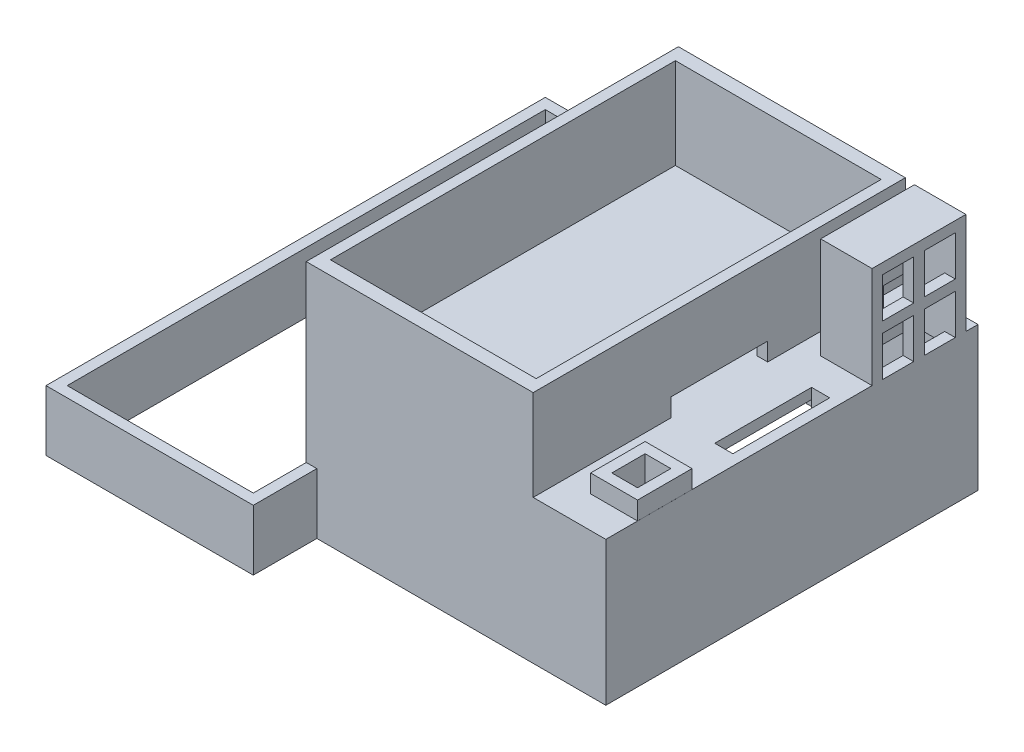
from build123d import *

# Parameters (mm, degrees)
SKETCH1_W               = 49.5
SKETCH1_H               = 61.5
BOSS_EXTRUDE1_DEPTH     = 23.75
SKETCH2_W               = 46
SKETCH2_H               = 58
CUT_EXTRUDE1_DEPTH      = 22
SKETCH3_W               = 3
SKETCH3_H               = 16
CUT_EXTRUDE2_DEPTH      = 1.75
SKETCH7_W               = 3
SKETCH7_H               = 5
BOSS_EXTRUDE2_DEPTH     = 4
SKETCH11_W              = 37.5
SKETCH11_H              = 61.5
BOSS_EXTRUDE3_DEPTH     = 15
SKETCH12_W              = 34
SKETCH12_H              = 57
CUT_EXTRUDE3_DEPTH      = 15
SKETCH14_W              = 7.75
SKETCH14_H              = 9
BOSS_EXTRUDE4_DEPTH     = 3
SKETCH15_W              = 4.25
SKETCH15_H              = 5.5
CUT_EXTRUDE4_DEPTH      = 4.75
SKETCH16_W              = 8.5
SKETCH16_H              = 15.5
BOSS_EXTRUDE5_DEPTH     = 16.75
SKETCH17_W              = 5.125
SKETCH17_H              = 6.625
CUT_EXTRUDE5_DEPTH      = 8.5
CUT_EXTRUDE6_DEPTH      = 15
CUT_EXTRUDE6_DEPTH_BACK = 1.75
SKETCH18_W              = 5
SKETCH18_H              = 12
SKETCH20_W              = 16
SKETCH20_H              = 3
CUT_EXTRUDE7_DEPTH      = 1.75
SKETCH21_W              = 34.25
SKETCH21_H              = 82.5
BOSS_EXTRUDE7_DEPTH     = 10
SKETCH23_W              = 30.75
SKETCH23_H              = 79
CUT_EXTRUDE8_DEPTH      = 10
SKETCH25_W              = 3
SKETCH25_H              = 5.25
BOSS_EXTRUDE8_DEPTH     = 1.75
SKETCH28_W              = 3
SKETCH28_H              = 2
BOSS_EXTRUDE9_DEPTH     = 1.75


with BuildPart() as part:
    # Sketch1 → Boss-Extrude1 (new body)
    with BuildSketch(Plane(origin=(0, 0, 0), x_dir=(1, 0, 0), z_dir=(0, 1, 0))):
        with Locations((-113.412024913, -45.391200727)):
            Rectangle(SKETCH1_W, SKETCH1_H)
    extrude(amount=BOSS_EXTRUDE1_DEPTH)

    # Sketch2 → Cut-Extrude1 (cut)
    with BuildSketch(Plane(origin=(0, 0, 0), x_dir=(-1, 0, 0), z_dir=(0, -1, 0))):
        with Locations((113.412024913, -45.391200727)):
            Rectangle(SKETCH2_W, SKETCH2_H)
    extrude(amount=-CUT_EXTRUDE1_DEPTH, mode=Mode.SUBTRACT)

    # Sketch3 → Cut-Extrude2 (cut)
    with BuildSketch(Plane(origin=(0, 22, 0), x_dir=(-1, 0, 0), z_dir=(0, -1, 0))):
        with Locations((91.912024913, -66.391200727)):
            Rectangle(SKETCH3_W, SKETCH3_H)
        with Locations((91.912024913, -24.391200727)):
            Rectangle(SKETCH3_W, SKETCH3_H)
        with Locations((91.912024913, -45.391200727)):
            Rectangle(SKETCH3_W, SKETCH3_H)
    extrude(amount=-CUT_EXTRUDE2_DEPTH, mode=Mode.SUBTRACT)

    # Sketch7 → Boss-Extrude2 (add)
    with BuildSketch(Plane(origin=(0, 22, 0), x_dir=(-1, 0, 0), z_dir=(0, -1, 0))):
        with Locations((91.912024913, -55.891200727)):
            Rectangle(SKETCH7_W, SKETCH7_H)
        with Locations((91.912024913, -34.891200727)):
            Rectangle(SKETCH7_W, SKETCH7_H)
    extrude(amount=BOSS_EXTRUDE2_DEPTH)

    # Sketch11 → Boss-Extrude3 (add)
    with BuildSketch(Plane(origin=(0, 23.75, 0), x_dir=(1, 0, 0), z_dir=(0, 1, 0))):
        with Locations((-119.412024913, -45.391200727)):
            Rectangle(SKETCH11_W, SKETCH11_H)
    extrude(amount=BOSS_EXTRUDE3_DEPTH)

    # Sketch12 → Cut-Extrude3 (cut)
    with BuildSketch(Plane(origin=(0, 38.75, 0), x_dir=(1, 0, 0), z_dir=(0, 1, 0))):
        with Locations((-119.412024913, -45.391200727)):
            Rectangle(SKETCH12_W, SKETCH12_H)
    extrude(amount=-CUT_EXTRUDE3_DEPTH, mode=Mode.SUBTRACT)

    # Sketch14 → Boss-Extrude4 (add)
    with BuildSketch(Plane(origin=(0, 23.75, 0), x_dir=(1, 0, 0), z_dir=(0, 1, 0))):
        with Locations((-92.542024913, -66.391200727)):
            Rectangle(SKETCH14_W, SKETCH14_H)
    extrude(amount=BOSS_EXTRUDE4_DEPTH)

    # Sketch15 → Cut-Extrude4 (cut)
    with BuildSketch(Plane(origin=(0, 26.75, 0), x_dir=(1, 0, 0), z_dir=(0, 1, 0))):
        with Locations((-92.542024913, -66.391200727)):
            Rectangle(SKETCH15_W, SKETCH15_H)
    extrude(amount=-CUT_EXTRUDE4_DEPTH, mode=Mode.SUBTRACT)

    # Sketch16 → Boss-Extrude5 (add)
    with BuildSketch(Plane(origin=(0, 23.75, 0), x_dir=(1, 0, 0), z_dir=(0, 1, 0))):
        with Locations((-92.912024913, -24.391200727)):
            Rectangle(SKETCH16_W, SKETCH16_H)
    extrude(amount=BOSS_EXTRUDE5_DEPTH)

    # Sketch17 → Cut-Extrude5 (cut)
    with BuildSketch(Plane(origin=(-88.662024913, 0, 0), x_dir=(0, 0, -1), z_dir=(1, 0, 0))):
        with Locations((-27.828700727, 35.4375)):
            Rectangle(SKETCH17_W, SKETCH17_H)
        with Locations((-27.828700727, 27.0625)):
            Rectangle(SKETCH17_W, SKETCH17_H)
        with Locations((-20.953700727, 35.4375)):
            Rectangle(SKETCH17_W, SKETCH17_H)
        with Locations((-20.953700727, 27.0625)):
            Rectangle(SKETCH17_W, SKETCH17_H)
    extrude(amount=-CUT_EXTRUDE5_DEPTH, mode=Mode.SUBTRACT)

    # Sketch18 → Cut-Extrude6 (cut, two sides: drawn at the far end of the back side and taken through both)
    with BuildSketch(Plane(origin=(0, 23.75, 0), x_dir=(1, 0, 0), z_dir=(0, 1, 0)).offset(-CUT_EXTRUDE6_DEPTH_BACK)):
        with Locations((-92.912024913, -24.391200727)):
            Rectangle(SKETCH18_W, SKETCH18_H)
    extrude(amount=CUT_EXTRUDE6_DEPTH + CUT_EXTRUDE6_DEPTH_BACK, mode=Mode.SUBTRACT)

    # Sketch20 → Cut-Extrude7 (cut)
    with BuildSketch(Plane(origin=(-100.662024913, 0, 0), x_dir=(0, 0, -1), z_dir=(1, 0, 0))):
        with Locations((-45.391200727, 25.25)):
            Rectangle(SKETCH20_W, SKETCH20_H)
    extrude(amount=-CUT_EXTRUDE7_DEPTH, mode=Mode.SUBTRACT)

    # Sketch21 → Boss-Extrude7 (add)
    with BuildSketch(Plane(origin=(0, 0, 0), x_dir=(-1, 0, 0), z_dir=(0, -1, 0))):
        with Locations((153.537024913, -45.391200727)):
            Rectangle(SKETCH21_W, SKETCH21_H)
    extrude(amount=-BOSS_EXTRUDE7_DEPTH)

    # Sketch23 → Cut-Extrude8 (cut)
    with BuildSketch(Plane(origin=(0, 10, 0), x_dir=(1, 0, 0), z_dir=(0, 1, 0))):
        with Locations((-153.537024913, -45.391200727)):
            Rectangle(SKETCH23_W, SKETCH23_H)
    extrude(amount=-CUT_EXTRUDE8_DEPTH, mode=Mode.SUBTRACT)

    # Sketch25 → Boss-Extrude8 (add)
    with BuildSketch(Plane(origin=(0, 22, 0), x_dir=(-1, 0, 0), z_dir=(0, -1, 0))):
        with Locations((91.912024913, -61.016200727)):
            Rectangle(SKETCH25_W, SKETCH25_H)
        with Locations((91.912024913, -71.766200727)):
            Rectangle(SKETCH25_W, SKETCH25_H)
    extrude(amount=-BOSS_EXTRUDE8_DEPTH)

    # Sketch28 → Boss-Extrude9 (add)
    with BuildSketch(Plane(origin=(0, 23.75, 0), x_dir=(1, 0, 0), z_dir=(0, 1, 0))):
        with Locations((-91.912024913, -17.391200727)):
            Rectangle(SKETCH28_W, SKETCH28_H)
        with Locations((-91.912024913, -31.391200727)):
            Rectangle(SKETCH28_W, SKETCH28_H)
    extrude(amount=-BOSS_EXTRUDE9_DEPTH)


solid = part.part
